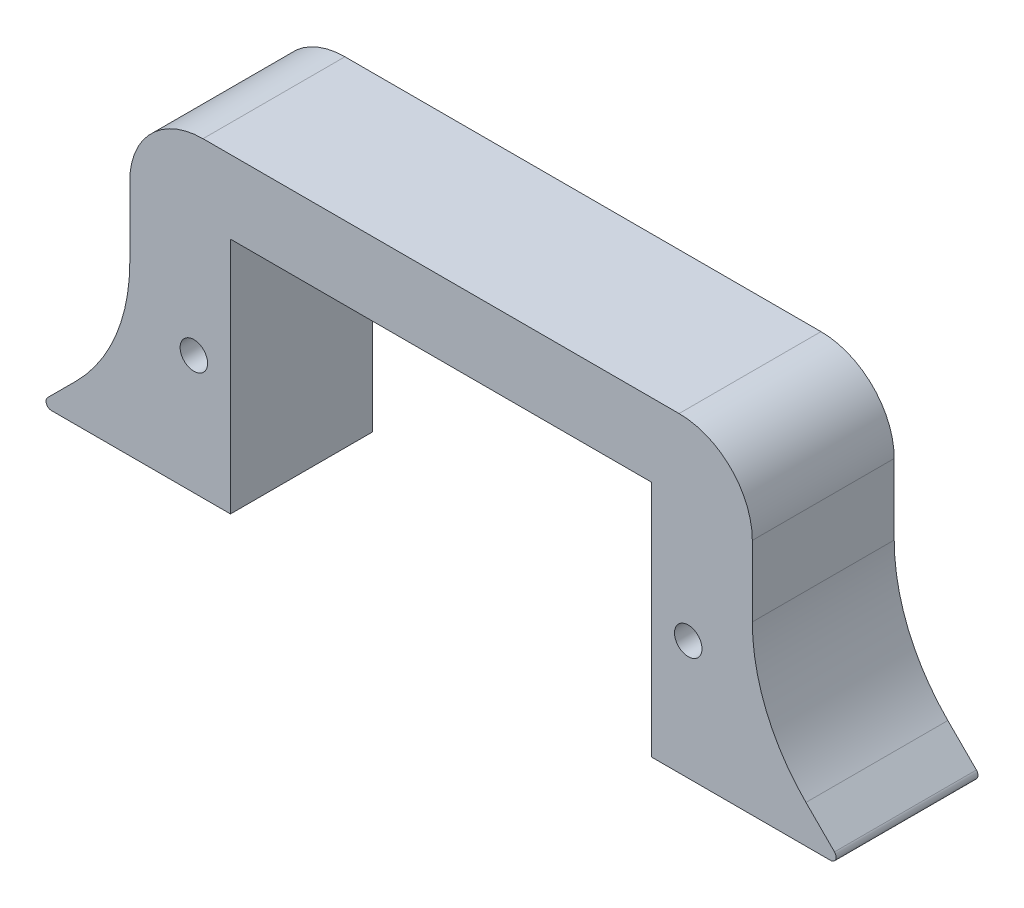
from build123d import *

# Parameters (mm, degrees)
BOSS_EXTRUDE1_DEPTH = 7.75
SKETCH2_R           = 0.75
CUT_EXTRUDE1_DEPTH  = 22.43157717
BOSS_EXTRUDE2_DEPTH = 7.75
SKETCH4_R           = 0.75
CUT_EXTRUDE2_DEPTH  = 2
FILLET1_R           = 10
FILLET2_R           = 4
FILLET3_R           = 0.3


with BuildPart() as part:
    # Sketch1 → Boss-Extrude1 (new body)
    with BuildSketch(Plane.XY):
        Polygon((11.5, -6.5), (17, -6.5), (17, 10.5), (-17, 10.5), (-17, -6.5), (-11.5, -6.5), (-11.5, 6.5), (11.5, 6.5), align=None)
    extrude(amount=BOSS_EXTRUDE1_DEPTH)

    # Sketch2 → Cut-Extrude1 (cut, through all)
    with BuildSketch(Plane.XY.offset(7.75)):
        with Locations((-13.5, 0)):
            Circle(SKETCH2_R)
        with Locations(Location((13.5, 0, 0), (0, 0, 180))):
            Circle(SKETCH2_R)
    extrude(amount=-CUT_EXTRUDE1_DEPTH, mode=Mode.SUBTRACT)

    # Sketch3 → Boss-Extrude2 (add)
    with BuildSketch(Plane.XY):
        Polygon((-17, -1.5), (-22, -6.5), (-17, -6.5), align=None)
        Polygon((17, -1.5), (22, -6.5), (17, -6.5), align=None)
    extrude(amount=BOSS_EXTRUDE2_DEPTH)

    # Sketch4 → Cut-Extrude2 (cut)
    with BuildSketch(Plane.XZ.offset(6.5)):
        with Locations((-16.75, 3.875)):
            Circle(SKETCH4_R)
        with Locations(Location((16.75, 3.875, 0), (0, 0, 180))):
            Circle(SKETCH4_R)
    extrude(amount=-CUT_EXTRUDE2_DEPTH, mode=Mode.SUBTRACT)

    # Fillet1
    fillet1_edges = [part.edges().sort_by_distance(p)[0] for p in [
        (-17, -1.5, 3.875),
        (17, -1.5, 3.875),
    ]]
    fillet(fillet1_edges, radius=FILLET1_R)

    # Fillet2
    fillet2_edges = [part.edges().sort_by_distance(p)[0] for p in [
        (-17, 10.5, 3.875),
        (17, 10.5, 3.875),
    ]]
    fillet(fillet2_edges, radius=FILLET2_R)

    # Fillet3
    fillet3_edges = [part.edges().sort_by_distance(p)[0] for p in [
        (-22, -6.5, 3.875),
        (22, -6.5, 3.875),
    ]]
    fillet(fillet3_edges, radius=FILLET3_R)


solid = part.part
